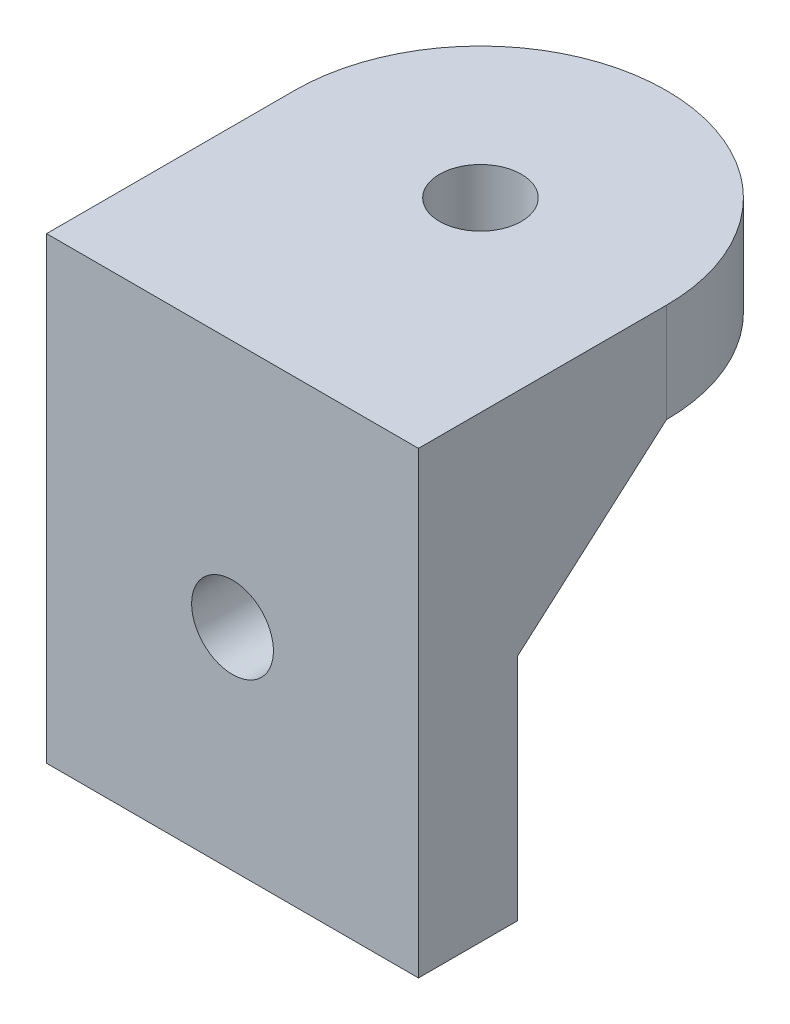
from build123d import *

# Parameters (mm, degrees)
SKETCH_1_W                   = 30
SKETCH_1_H                   = 37
EXTRUDE_1_DEPTH              = 8
EXTRUDE_2_DEPTH              = 8
EXTRUDE_3_DEPTH              = 3.8
HOLE_WIZARD_M6_1_D           = 6.6
HOLE_WIZARD_M6_1_CSINK_D     = 12.6
HOLE_WIZARD_M6_1_CSINK_ANGLE = 90
HOLE_WIZARD_M6_2_D           = 6.6
HOLE_WIZARD_M6_2_CSINK_D     = 12.6
HOLE_WIZARD_M6_2_CSINK_ANGLE = 90


with BuildPart() as part:
    # 草图1 → 凸台-拉伸1 (new body)
    with BuildSketch(Plane.XY):
        Rectangle(SKETCH_1_W, SKETCH_1_H)
    extrude(amount=EXTRUDE_1_DEPTH)

    # 草图2 → 凸台-拉伸2 (add)
    with BuildSketch(Plane(origin=(0, 18.5, 0), x_dir=(1, 0, 0), z_dir=(0, 1, 0))):
        with BuildLine():
            Line((-15, -8), (15, -8))
            Line((15, -8), (15, 12))
            ThreePointArc((15, 12), (0, 27), (-15, 12))
            Line((-15, 12), (-15, -8))
        make_face()
    extrude(amount=-EXTRUDE_2_DEPTH)

    # 草图5 → 凸台-拉伸3 (add)
    with BuildSketch(Plane(origin=(15, 0, 0), x_dir=(0, 0, -1), z_dir=(1, 0, 0))):
        Polygon((12, 10.5), (0, 10.5), (0, 0), align=None)
    extrude_3 = extrude(amount=-EXTRUDE_3_DEPTH)

    # 镜向1: 凸台-拉伸3 across plane
    add(extrude_3.mirror(Plane(origin=(0, 0, 0), x_dir=(0, 0, 1), z_dir=(1, 0, 0))))

    # M6 平锥沉头螺钉的锥形沉头孔1 (through all)
    with Locations(Plane(origin=(0, 0, 0), x_dir=(-1, 0, 0), z_dir=(0, 0, -1))):
        with Locations((0, -1.5)):
            CounterSinkHole(HOLE_WIZARD_M6_1_D / 2, HOLE_WIZARD_M6_1_CSINK_D / 2, counter_sink_angle=HOLE_WIZARD_M6_1_CSINK_ANGLE)

    # M6 平锥沉头螺钉的锥形沉头孔2 (through all)
    with Locations(Plane.XZ.offset(-10.5)):
        with Locations((0, -12)):
            CounterSinkHole(HOLE_WIZARD_M6_2_D / 2, HOLE_WIZARD_M6_2_CSINK_D / 2, counter_sink_angle=HOLE_WIZARD_M6_2_CSINK_ANGLE)


solid = part.part
